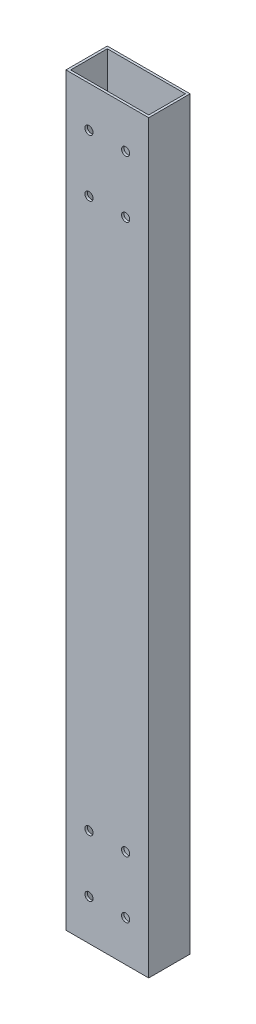
from build123d import *

# Parameters (mm, degrees)
SKETCH1_W           = 50.8
SKETCH1_H           = 25.4
SKETCH1_W_2         = 47.9
SKETCH1_H_2         = 22.5
BOSS_EXTRUDE1_DEPTH = 457.2
SKETCH2_R           = 2.5
CUT_EXTRUDE1_DEPTH  = 459.608940166


with BuildPart() as part:
    # Sketch1 → Boss-Extrude1 (new body)
    with BuildSketch(Plane(origin=(0, 0, 0), x_dir=(1, 0, 0), z_dir=(0, 1, 0))):
        Rectangle(SKETCH1_W, SKETCH1_H)
        Rectangle(SKETCH1_W_2, SKETCH1_H_2, mode=Mode.SUBTRACT)
    extrude(amount=BOSS_EXTRUDE1_DEPTH)

    # Sketch2 → Cut-Extrude1 (cut, through all)
    with BuildSketch(Plane.XY.offset(12.7)):
        with Locations((-11.25, 60)):
            Circle(SKETCH2_R)
        with Locations((-11.25, 25)):
            Circle(SKETCH2_R)
        with Locations((11.25, 25)):
            Circle(SKETCH2_R)
        with Locations((11.25, 60)):
            Circle(SKETCH2_R)
    cut_extrude1 = extrude(amount=-CUT_EXTRUDE1_DEPTH, mode=Mode.SUBTRACT)

    # Mirror1: Cut-Extrude1 across plane
    add(cut_extrude1.mirror(Plane.ZX.offset(228.6)), mode=Mode.SUBTRACT)


solid = part.part
